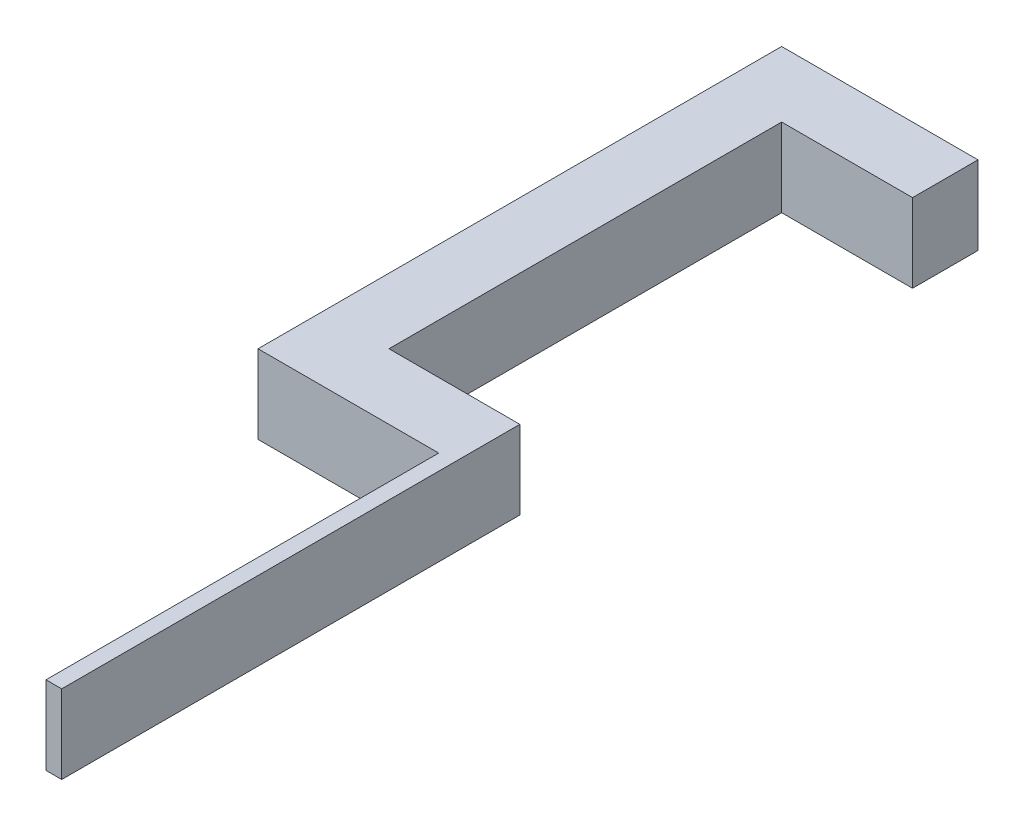
from build123d import *

# Parameters (mm, degrees)
BOSS_EXTRUDE1_DEPTH = 3


with BuildPart() as part:
    # Sketch1 → Boss-Extrude1 (new body)
    with BuildSketch(Plane(origin=(0, 0, 0), x_dir=(1, 0, 0), z_dir=(0, 1, 0))):
        Polygon((0, 20), (0, 17.5), (-5, 17.5), (-5, 2.5), (0, 2.5), (0, -15), (-0.6, -15), (-0.6, 0), (-7.5, 0), (-7.5, 20), align=None)
    extrude(amount=BOSS_EXTRUDE1_DEPTH)


solid = part.part
